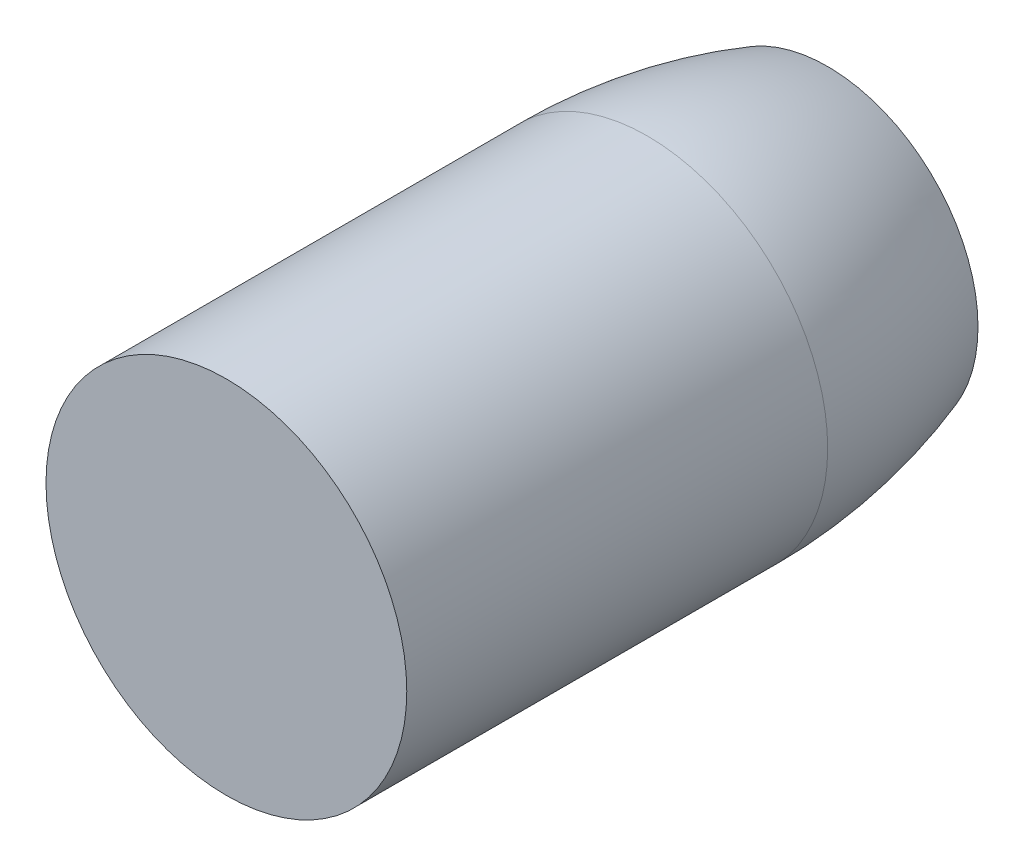
from build123d import *


with BuildPart() as part:
    # Sketch1 → Revolve1 (revolve)
    with BuildSketch(Plane(origin=(0, 0, 0), x_dir=(1, 0, 0), z_dir=(0, 1, 0))):
        with BuildLine():
            Line((0, 0), (6, 0))
            Line((6, 0), (6, 14))
            ThreePointArc((6, 14), (5.748287591, 17.041381265), (5, 20))
            Line((5, 20), (4.75, 20))
            Line((4.75, 20), (4.75, 17))
            Line((4.75, 17), (0, 17))
            Line((0, 17), (0, 0))
        make_face()
    revolve(axis=Axis((0, 0, 0), (0, 0, -1)))


solid = part.part
